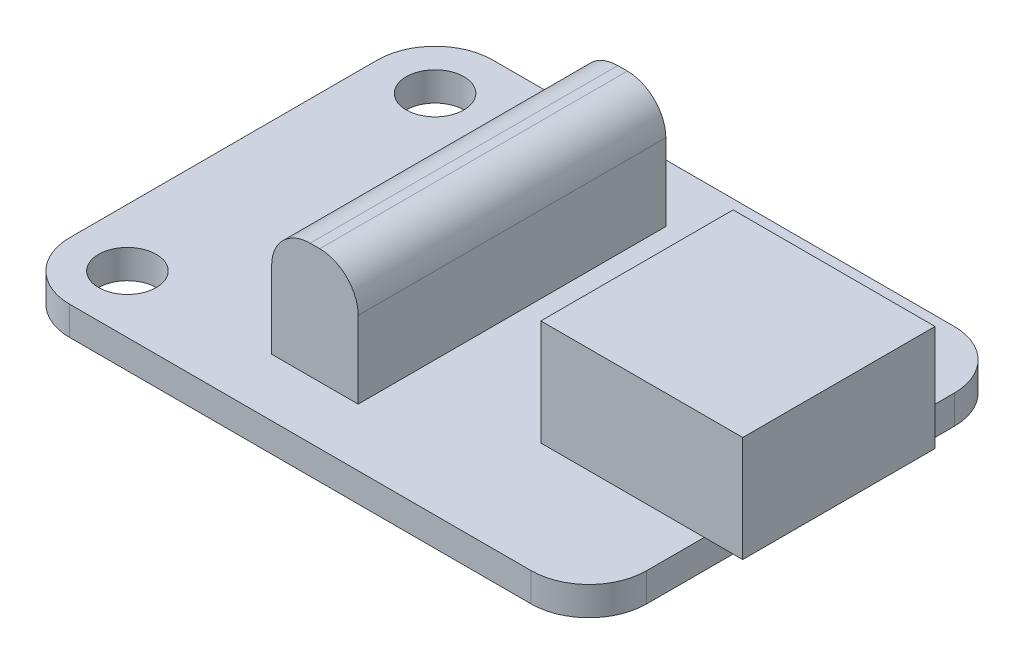
from build123d import *

# Parameters (mm, degrees)
SKETCH_1_R      = 1.5
EXTRUDE_1_DEPTH = 1.5
EXTRUDE_2_DEPTH = 5.5
SKETCH_3_W      = 4.5
SKETCH_3_H      = 16
EXTRUDE_3_DEPTH = 6
FILLET_1_R      = 2


with BuildPart() as part:
    # Эскиз1 → Бобышка-Вытянуть1 (new body)
    with BuildSketch(Plane(origin=(0, 0, 0), x_dir=(1, 0, 0), z_dir=(0, 1, 0))):
        with BuildLine():
            Line((-28.198313686, 2.834587413), (-28.198313686, -13.165412587))
            ThreePointArc((-28.198313686, -13.165412587), (-27.31963403, -15.286732931), (-25.198313686, -16.165412587))
            Line((-25.198313686, -16.165412587), (-1.198313686, -16.165412587))
            ThreePointArc((-1.198313686, -16.165412587), (0.923006657, -15.286732931), (1.801686314, -13.165412587))
            Line((1.801686314, -13.165412587), (1.801686314, 2.834587413))
            ThreePointArc((1.801686314, 2.834587413), (0.923006657, 4.955907756), (-1.198313686, 5.834587413))
            Line((-1.198313686, 5.834587413), (-25.198313686, 5.834587413))
            ThreePointArc((-25.198313686, 5.834587413), (-27.31963403, 4.955907756), (-28.198313686, 2.834587413))
        make_face()
        with Locations(Location((-25.198313686, -13.165412587, 0), (0, 0, 270))):
            Circle(SKETCH_1_R, mode=Mode.SUBTRACT)
        with Locations(Location((-25.198313686, 2.834587413, 0), (0, 0, 270))):
            Circle(SKETCH_1_R, mode=Mode.SUBTRACT)
    extrude(amount=EXTRUDE_1_DEPTH)

    # Эскиз2 → Бобышка-Вытянуть2 (add)
    with BuildSketch(Plane(origin=(0, 1.5, 0), x_dir=(1, 0, 0), z_dir=(0, 1, 0))):
        Polygon((1.801686314, -0.165412587), (-6.698313686, -0.165412587), (-6.698313686, -10.165412587), (1.801686314, -10.165412587), (3.801686314, -10.165412587), (3.801686314, -0.165412587), align=None)
    extrude(amount=EXTRUDE_2_DEPTH)

    # Эскиз3 → Бобышка-Вытянуть3 (add)
    with BuildSketch(Plane(origin=(0, 1.5, 0), x_dir=(1, 0, 0), z_dir=(0, 1, 0))):
        with Locations((-15.448313686, -5.165412587)):
            Rectangle(SKETCH_3_W, SKETCH_3_H)
    extrude(amount=EXTRUDE_3_DEPTH)

    # Скругление1
    fillet_1_edges = [part.edges().sort_by_distance(p)[0] for p in [
        (-17.698313686, 7.5, 5.165412587),
        (-13.198313686, 7.5, 5.165412587),
    ]]
    fillet(fillet_1_edges, radius=FILLET_1_R)


solid = part.part
